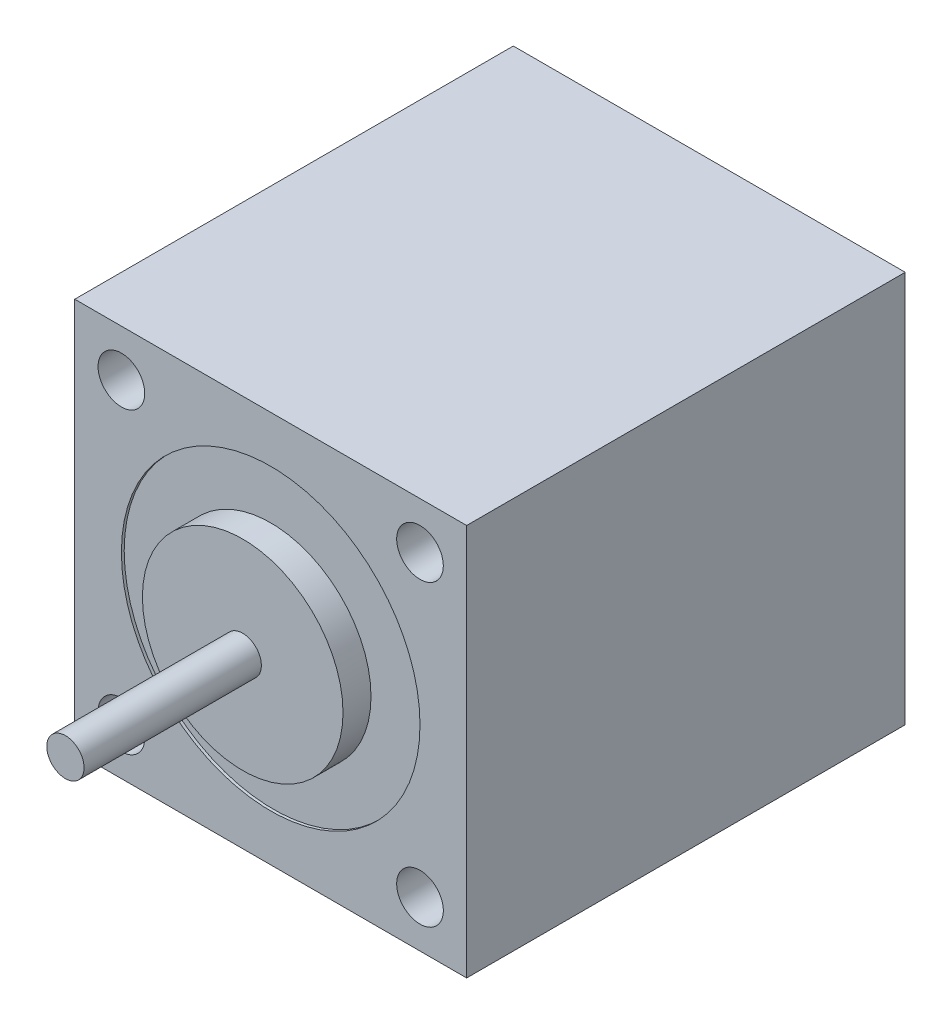
from build123d import *

# Parameters (mm, degrees)
SKETCH1_W           = 42
SKETCH1_H           = 42
BOSS_EXTRUDE1_DEPTH = 47
SKETCH2_R           = 2.5
CUT_EXTRUDE1_DEPTH  = 47
SKETCH13_R          = 10.75
BOSS_EXTRUDE5_DEPTH = 3
SKETCH12_R          = 16
CUT_EXTRUDE2_DEPTH  = 0.3
SKETCH14_R          = 2
BOSS_EXTRUDE6_DEPTH = 19


with BuildPart() as part:
    # Sketch1 → Boss-Extrude1 (new body)
    with BuildSketch(Plane.XY):
        Rectangle(SKETCH1_W, SKETCH1_H)
    extrude(amount=BOSS_EXTRUDE1_DEPTH)

    # Sketch2 → Cut-Extrude1 (cut)
    with BuildSketch(Plane.XY.offset(47)):
        with Locations((16, 16)):
            Circle(SKETCH2_R)
        with Locations(Location((-16, 16, 0), (0, 0, 180))):
            Circle(SKETCH2_R)
        with Locations(Location((16, -16, 0), (0, 0, 180))):
            Circle(SKETCH2_R)
        with Locations((-16, -16)):
            Circle(SKETCH2_R)
    extrude(amount=-CUT_EXTRUDE1_DEPTH, mode=Mode.SUBTRACT)

    # Sketch13 → Boss-Extrude5 (add)
    with BuildSketch(Plane.XY.offset(47)):
        with Locations(Location((0, 0, 0), (0, 0, 180))):
            Circle(SKETCH13_R)
    extrude(amount=BOSS_EXTRUDE5_DEPTH)

    # Sketch12 → Cut-Extrude2 (cut)
    with BuildSketch(Plane.XY.offset(47)):
        Circle(SKETCH12_R)
    extrude(amount=-CUT_EXTRUDE2_DEPTH, mode=Mode.SUBTRACT)


with BuildPart() as cut_extrude2_piece_1:
    # of the separate pieces the step leaves, piece 1, a body of its own (cut_extrude2_pieces)
    add(part.part.solids().sort_by_distance((-21, -21, 0))[0])


with BuildPart() as cut_extrude2_piece_2:
    # of the separate pieces the step leaves, piece 2, a body of its own (cut_extrude2_pieces)
    add(part.part.solids().sort_by_distance((-10.75, 0, 47))[0])

    # Sketch14 → Boss-Extrude6 (add)
    with BuildSketch(Plane.XY.offset(50)):
        Circle(SKETCH14_R)
    extrude(amount=BOSS_EXTRUDE6_DEPTH)


solid = Compound([cut_extrude2_piece_1.part, cut_extrude2_piece_2.part])
